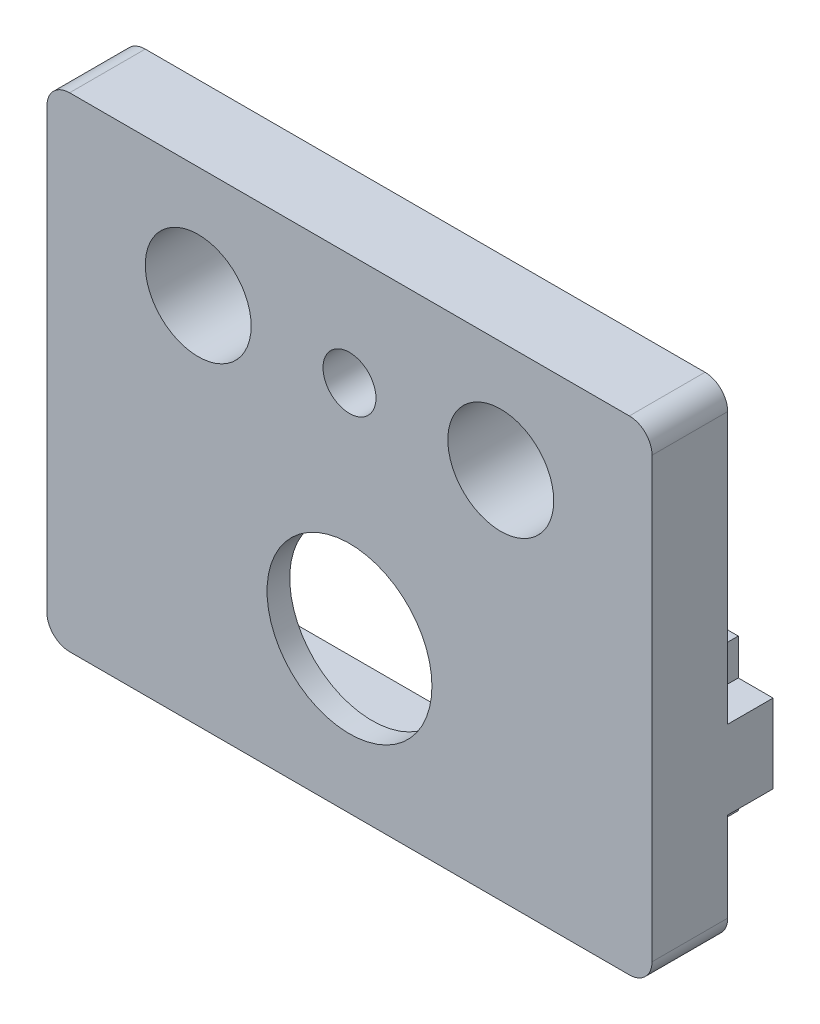
from build123d import *

# Parameters (mm, degrees)
SKETCH_1_W          = 40
SKETCH_1_H          = 20
EXTRUDE_1_DEPTH     = 3.5
SKETCH_2_W          = 40
SKETCH_2_H          = 20
SKETCH_2_R          = 5.25
EXTRUDE_2_DEPTH     = 1.5
EXTRUDE_3_DEPTH     = 8
SKETCH_4_W          = 40
SKETCH_4_H          = 12
SKETCH_4_R          = 3.5
EXTRUDE_4_DEPTH     = 5
FILLET_1_R          = 1.5
SKETCH_5_R          = 1.75
CUT_EXTRUDE_1_DEPTH = 5
CUT_EXTRUDE_2_DEPTH = 3
CUT_EXTRUDE_3_DEPTH = 3.5
CUT_EXTRUDE_START   = -3.5
SKETCH_8_R          = 5.45
SKETCH_8_R_2        = 5.25
CUT_EXTRUDE_4_DEPTH = 3.5


with BuildPart() as part:
    # 草图1 → 凸台-拉伸1 (new body)
    with BuildSketch(Plane.XY):
        Rectangle(SKETCH_1_W, SKETCH_1_H)
        with BuildLine():
            Line((-9.5, -5.75), (9.5, -5.75))
            ThreePointArc((9.5, -5.75), (11, 0), (9.5, 5.75))
            Line((9.5, 5.75), (-9.5, 5.75))
            ThreePointArc((-9.5, 5.75), (-11, 0), (-9.5, -5.75))
        make_face(mode=Mode.SUBTRACT)
    extrude(amount=EXTRUDE_1_DEPTH)

    # 草图2 → 凸台-拉伸2 (add)
    with BuildSketch(Plane.XY.offset(3.5)):
        Rectangle(SKETCH_2_W, SKETCH_2_H)
        Circle(SKETCH_2_R, mode=Mode.SUBTRACT)
    extrude(amount=EXTRUDE_2_DEPTH)

    # 草图3 → 凸台-拉伸3 (add)
    with BuildSketch(Plane.XY.offset(5)):
        Polygon((-16.560660172, 5.5), (-18.2, 5.5), (-18.2, 3.1), (-20, 3.1), (-20, -3.1), (-18.2, -3.1), (-18.2, -5.5), (-16.560660172, -5.5), (-13.9, -2.839339828), (-13.9, 2.839339828), align=None)
        Polygon((18.2, 3.1), (20, 3.1), (20, -3.1), (18.2, -3.1), (18.2, -5.5), (16.560660172, -5.5), (13.9, -2.839339828), (13.9, 2.839339828), (16.560660172, 5.5), (18.2, 5.5), align=None)
    extrude(amount=-EXTRUDE_3_DEPTH)

    # 草图4 → 凸台-拉伸4 (add)
    with BuildSketch(Plane.XY.offset(5)):
        with Locations((0, 16)):
            Rectangle(SKETCH_4_W, SKETCH_4_H)
        with Locations((-10, 14.64)):
            Circle(SKETCH_4_R, mode=Mode.SUBTRACT)
        with Locations((10, 14.64)):
            Circle(SKETCH_4_R, mode=Mode.SUBTRACT)
    extrude(amount=-EXTRUDE_4_DEPTH)

    # 圆角1
    fillet_1_edges = [part.edges().sort_by_distance(p)[0] for p in [
        (20, 22, 2.5),
        (-20, 22, 2.5),
        (20, -10, 2.5),
        (-20, -10, 2.5),
    ]]
    fillet(fillet_1_edges, radius=FILLET_1_R)

    # 草图5 → 切除-拉伸1 (cut)
    with BuildSketch(Plane.XY.offset(5)):
        with Locations((0, 14.64)):
            Circle(SKETCH_5_R)
    extrude(amount=-CUT_EXTRUDE_1_DEPTH, mode=Mode.SUBTRACT)

    # 草图6 → 切除-拉伸2 (cut)
    with BuildSketch(Plane(origin=(0, 0, -3), x_dir=(-1, 0, 0), z_dir=(0, 0, -1))):
        Polygon((-18.2, 5.5), (-18.2, 3.1), (-20, 3.1), (-20, 2.6), (-19.5, 2.6), (-17.7, 2.6), (-17.7, 5), (-16.767766953, 5), (-14.4, 2.632233047), (-14.4, -2.632233047), (-16.767766953, -5), (-17.7, -5), (-17.7, -2.6), (-19.5, -2.6), (-20, -2.6), (-20, -3.1), (-18.2, -3.1), (-18.2, -5.5), (-16.560660172, -5.5), (-13.9, -2.839339828), (-13.9, 2.839339828), (-16.560660172, 5.5), align=None)
        Polygon((18.2, -5.5), (18.2, -3.1), (20, -3.1), (20, -2.6), (19.5, -2.6), (17.7, -2.6), (17.7, -5), (16.767766953, -5), (14.4, -2.632233047), (14.4, 2.632233047), (16.767766953, 5), (17.7, 5), (17.7, 2.6), (19.5, 2.6), (20, 2.6), (20, 3.1), (18.2, 3.1), (18.2, 5.5), (16.560660172, 5.5), (13.9, 2.839339828), (13.9, -2.839339828), (16.560660172, -5.5), align=None)
    extrude(amount=-CUT_EXTRUDE_2_DEPTH, mode=Mode.SUBTRACT)

    # 草图7 → 切除-拉伸3 (cut)
    with BuildSketch(Plane(origin=(0, 0, 0), x_dir=(-1, 0, 0), z_dir=(0, 0, -1))):
        with BuildLine():
            Line((9.616579756, 5.95), (-9.616579756, 5.95))
            ThreePointArc((-9.616579756, 5.95), (-11.2, 0), (-9.616579756, -5.95))
            Line((-9.616579756, -5.95), (9.616579756, -5.95))
            ThreePointArc((9.616579756, -5.95), (11.2, 0), (9.616579756, 5.95))
        make_face()
    extrude(amount=-CUT_EXTRUDE_3_DEPTH, mode=Mode.SUBTRACT)

    # 草图8 → 切除-拉伸4 (cut)
    with BuildSketch(Plane.XY.offset(5).offset(CUT_EXTRUDE_START)):
        Circle(SKETCH_8_R)
        Circle(SKETCH_8_R_2, mode=Mode.SUBTRACT)
    extrude(amount=CUT_EXTRUDE_4_DEPTH, mode=Mode.SUBTRACT)


solid = part.part
